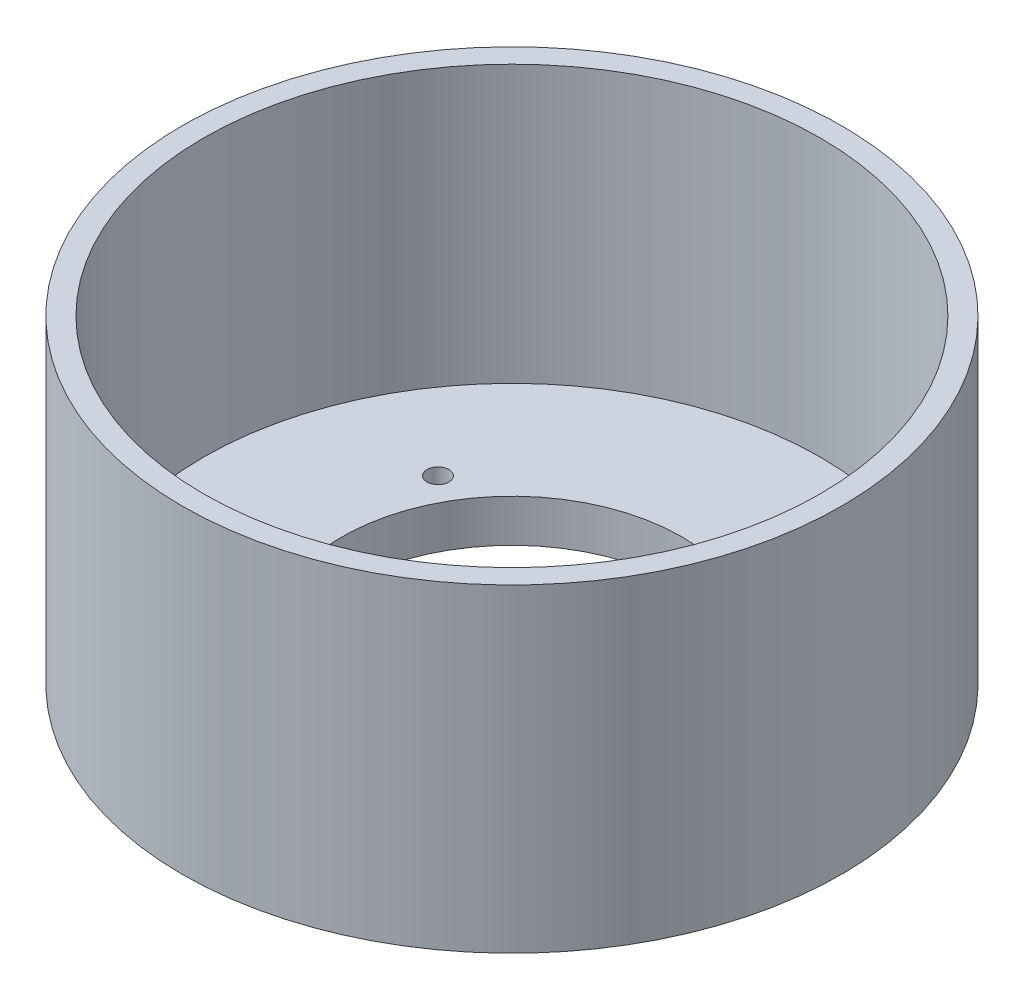
from build123d import *

# Parameters (mm, degrees)
SKETCH_1_R               = 31
EXTRUDE_1_DEPTH          = 30
CUT_EXTRUDE_3_DEPTH      = 51.467811524
CUT_EXTRUDE_3_DEPTH_BACK = 51.467811524
SKETCH_5_R               = 16
SKETCH_6_R               = 29
CUT_EXTRUDE_4_DEPTH      = 26
HOLE_WIZARD_M2_5_1_D     = 2.05


with BuildPart() as part:
    # 草图1 → 凸台-拉伸1 (new body)
    with BuildSketch(Plane(origin=(0, 0, 0), x_dir=(1, 0, 0), z_dir=(0, 1, 0))):
        with Locations(Location((0, 0, 0), (0, 0, 270))):
            Circle(SKETCH_1_R)
    extrude(amount=EXTRUDE_1_DEPTH)

    # 草图5 → 切除-拉伸3 (cut, two sides: drawn at the far end of the back side and taken through both)
    with BuildSketch(Plane(origin=(0, 5, 0), x_dir=(-1, 0, 0), z_dir=(0, -1, 0)).offset(-CUT_EXTRUDE_3_DEPTH_BACK)):
        with Locations(Location((0, 0, 0), (0, 0, 90))):
            Circle(SKETCH_5_R)
    extrude(amount=CUT_EXTRUDE_3_DEPTH + CUT_EXTRUDE_3_DEPTH_BACK, mode=Mode.SUBTRACT)

    # 草图6 → 切除-拉伸4 (cut)
    with BuildSketch(Plane(origin=(0, 30, 0), x_dir=(1, 0, 0), z_dir=(0, 1, 0))):
        with Locations(Location((0, 0, 0), (0, 0, 270))):
            Circle(SKETCH_6_R)
    extrude(amount=-CUT_EXTRUDE_4_DEPTH, mode=Mode.SUBTRACT)

    # M2.5 螺纹孔1 (through all)
    with Locations(Plane(origin=(0, 4, 0), x_dir=(1, 0, 0), z_dir=(0, 1, 0))):
        with Locations((-16.455, 9.5), (16.455, 9.5), (16.455, -9.5), (-16.455, -9.5)):
            Hole(HOLE_WIZARD_M2_5_1_D / 2)


solid = part.part
